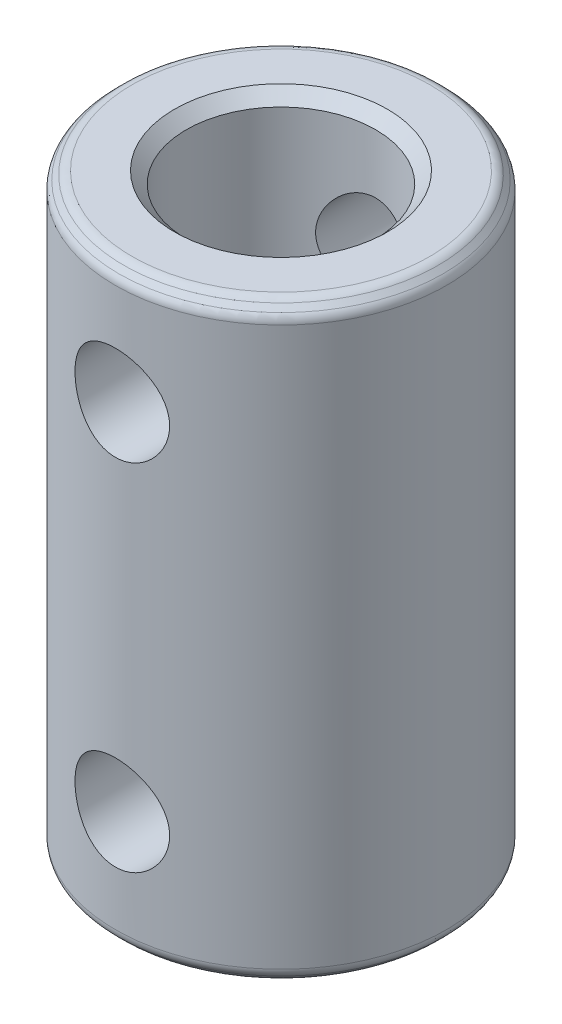
from build123d import *

# Parameters (mm, degrees)
WYTNIJ_WYCI_GNI_CIE1_DEPTH      = 42.958230131
WYTNIJ_WYCI_GNI_CIE1_DEPTH_BACK = 42.958230131
SZKIC2_R                        = 2
SFAZOWANIE1_SIZE                = 0.5
ZAOKR_GLENIE1_R                 = 0.5
SFAZOWANIE2_SIZE                = 0.5


with BuildPart() as part:
    # Szkic1 → Obrót1 (revolve)
    with BuildSketch(Plane.XY, mode=Mode.PRIVATE) as obr_t1_sk:
        Polygon((-20.921239747, -8.753034896), (-23.921239747, -8.753034896), (-23.921239747, -33.753034896), (-19.421239747, -33.753034896), (-19.421239747, -21.753034896), (-20.921239747, -21.753034896), align=None)
    revolve(obr_t1_sk.sketch.rotate(Axis((-16.921239747, -33.753034896, 0), (0, 1, 0)), 270), axis=Axis((-16.921239747, -33.753034896, 0), (0, 1, 0)))

    # Szkic2 → Wytnij-wyciągnięcie1 (cut, two sides: drawn at the far end of the back side and taken through both)
    with BuildSketch(Plane.XY.offset(-WYTNIJ_WYCI_GNI_CIE1_DEPTH_BACK)):
        with Locations((-16.921239747, -13.753034896)):
            Circle(SZKIC2_R)
        with Locations((-16.921239747, -28.753034896)):
            Circle(SZKIC2_R)
    extrude(amount=WYTNIJ_WYCI_GNI_CIE1_DEPTH + WYTNIJ_WYCI_GNI_CIE1_DEPTH_BACK, mode=Mode.SUBTRACT)

    # Sfazowanie1
    sfazowanie1_edges = [part.edges().sort_by_distance(p)[0] for p in [
        (-16.921239747, -33.753034896, 2.5),
        (-16.921239747, -33.753034896, 7),
        (-16.921239747, -8.753034896, 7),
        (-16.921239747, -8.753034896, 4),
    ]]
    chamfer(sfazowanie1_edges, length=SFAZOWANIE1_SIZE)

    # Zaokrąglenie1
    zaokr_glenie1_edges = [part.edges().sort_by_distance(p)[0] for p in [
        (-16.921239747, -33.753034896, 6.5),
        (-16.921239747, -9.253034896, 7),
        (-16.921239747, -33.253034896, 7),
        (-16.921239747, -8.753034896, 6.5),
    ]]
    fillet(zaokr_glenie1_edges, radius=ZAOKR_GLENIE1_R)

    # Sfazowanie2
    sfazowanie2_edges = [part.edges().sort_by_distance(p)[0] for p in [
        (-16.921239747, -21.753034896, 2.5),
    ]]
    chamfer(sfazowanie2_edges, length=SFAZOWANIE2_SIZE)


solid = part.part
